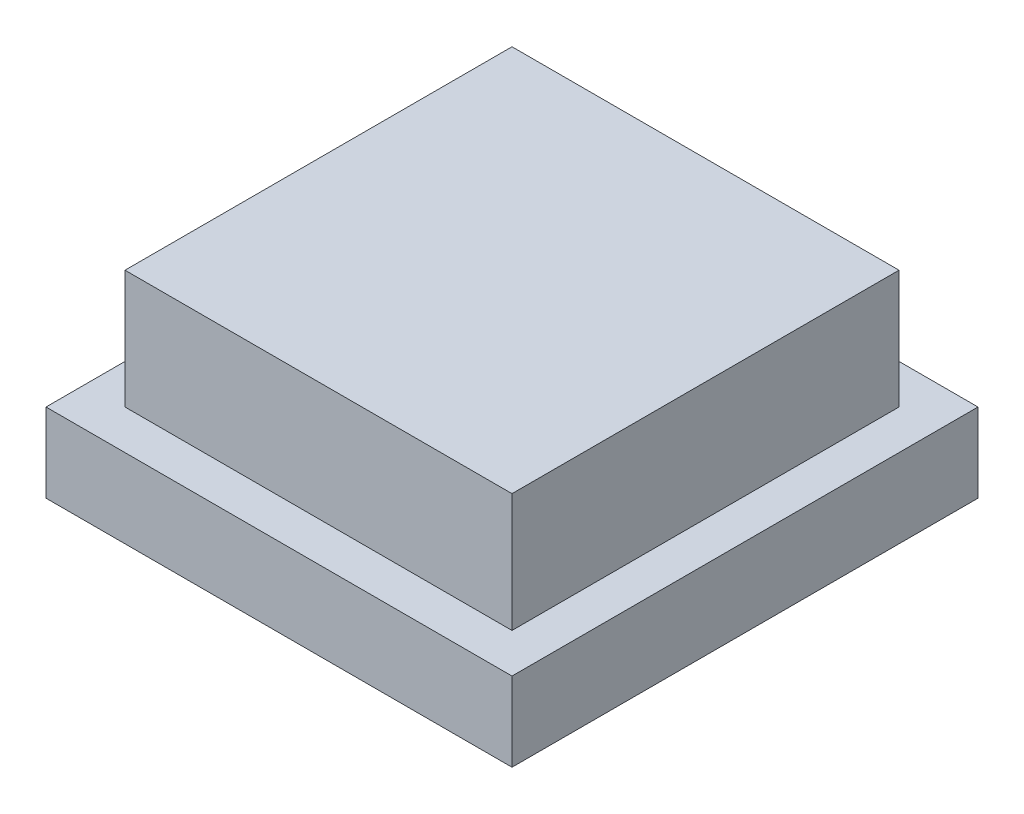
from build123d import *

# Parameters (mm, degrees)
SKETCH1_W           = 9.8
SKETCH1_H           = 9.8
BOSS_EXTRUDE4_DEPTH = 5
SKETCH1_4_W         = 11.8
SKETCH1_4_H         = 11.8
SKETCH1_4_W_2       = 9.8
SKETCH1_4_H_2       = 9.8
BOSS_EXTRUDE5_DEPTH = 2


with BuildPart() as part:
    # Sketch1 → Boss-Extrude4 (new body)
    with BuildSketch(Plane(origin=(0, 0, 0), x_dir=(1, 0, 0), z_dir=(0, 1, 0))):
        with Locations((-1.789763059, -1.443740832)):
            Rectangle(SKETCH1_W, SKETCH1_H)
    extrude(amount=BOSS_EXTRUDE4_DEPTH)

    # Sketch1<4> → Boss-Extrude5 (add)
    with BuildSketch(Plane(origin=(0, 0, 0), x_dir=(1, 0, 0), z_dir=(0, 1, 0))):
        with Locations((-1.789763059, -1.443740832)):
            Rectangle(SKETCH1_4_W, SKETCH1_4_H)
        with Locations((-1.789763059, -1.443740832)):
            Rectangle(SKETCH1_4_W_2, SKETCH1_4_H_2, mode=Mode.SUBTRACT)
    extrude(amount=BOSS_EXTRUDE5_DEPTH)


solid = part.part
